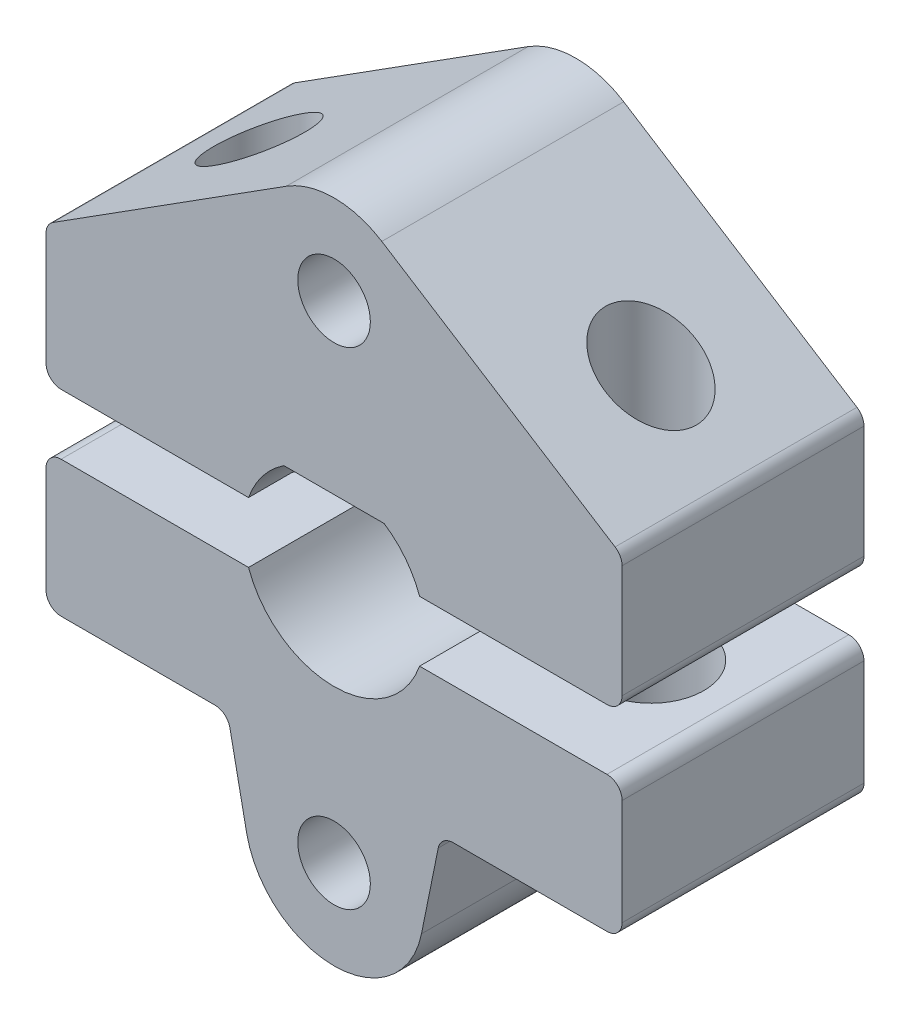
from build123d import *

# Parameters (mm, degrees)
SKETCH_1_R          = 1.2
EXTRUDE_1_DEPTH     = 8
EXTRUDE_1_2_DEPTH   = 8
SKETCH_2_R          = 1.5
CUT_EXTRUDE_1_DEPTH = 21.66397832
SKETCH_3_R          = 1.75
CUT_EXTRUDE_2_DEPTH = 4.5


with BuildPart() as part:
    # 草图1 → 凸台-拉伸1 (new body)
    with BuildSketch(Plane.XY):
        with BuildLine():
            Line((-1.658312395, 2.5), (1.658312395, 2.5))
            ThreePointArc((1.658312395, 2.5), (2.365419176, 1.84520788), (2.828427125, 1))
            Line((2.828427125, 1), (9.026279442, 1))
            ThreePointArc((9.026279442, 1), (9.379832832, 1.146446609), (9.526279442, 1.5))
            Line((9.526279442, 1.5), (9.526279442, 5.22507425))
            ThreePointArc((9.526279442, 5.22507425), (9.464414867, 5.465983671), (9.294130046, 5.647278056))
            Line((9.294130046, 5.647278056), (1.580318565, 10.541002455))
            ThreePointArc((1.580318565, 10.541002455), (0, 11), (-1.580318565, 10.541002455))
            Line((-1.580318565, 10.541002455), (-9.294130046, 5.647278056))
            ThreePointArc((-9.294130046, 5.647278056), (-9.464414867, 5.465983671), (-9.526279442, 5.22507425))
            Line((-9.526279442, 5.22507425), (-9.526279442, 1.5))
            ThreePointArc((-9.526279442, 1.5), (-9.379832832, 1.146446609), (-9.026279442, 1))
            Line((-9.026279442, 1), (-2.828427125, 1))
            ThreePointArc((-2.828427125, 1), (-2.365419176, 1.84520788), (-1.658312395, 2.5))
        make_face()
        with Locations((0, 8.05)):
            Circle(SKETCH_1_R, mode=Mode.SUBTRACT)
    extrude(amount=EXTRUDE_1_DEPTH)


with BuildPart() as body_2:
    # 草图1 → Extrude 1 2 (new body)
    with BuildSketch(Plane.XY):
        with BuildLine():
            Line((-9.026279442, -1), (-2.828427125, -1))
            ThreePointArc((-2.828427125, -1), (0, -3), (2.828427125, -1))
            Line((2.828427125, -1), (9.026279442, -1))
            ThreePointArc((9.026279442, -1), (9.379832832, -1.146446609), (9.526279442, -1.5))
            Line((9.526279442, -1.5), (9.526279442, -5))
            ThreePointArc((9.526279442, -5), (9.379832832, -5.353553391), (9.026279442, -5.5))
            Line((9.026279442, -5.5), (3.935174447, -5.5))
            ThreePointArc((3.935174447, -5.5), (3.6186464, -5.612947037), (3.445121974, -5.900760016))
            Line((3.445121974, -5.900760016), (2.891309587, -8.635515904))
            ThreePointArc((2.891309587, -8.635515904), (0, -11), (-2.891309587, -8.635515904))
            Line((-2.891309587, -8.635515904), (-3.445121974, -5.900760016))
            ThreePointArc((-3.445121974, -5.900760016), (-3.6186464, -5.612947037), (-3.935174447, -5.5))
            Line((-3.935174447, -5.5), (-9.026279442, -5.5))
            ThreePointArc((-9.026279442, -5.5), (-9.379832832, -5.353553391), (-9.526279442, -5))
            Line((-9.526279442, -5), (-9.526279442, -1.5))
            ThreePointArc((-9.526279442, -1.5), (-9.379832832, -1.146446609), (-9.026279442, -1))
        make_face()
        with Locations((0, -8.05)):
            Circle(SKETCH_1_R, mode=Mode.SUBTRACT)
    extrude(amount=EXTRUDE_1_2_DEPTH)


with BuildPart() as cut_extrude_1_tool:
    # 草图2 → 切除-拉伸1 (new, through all)
    with BuildSketch(Plane.XZ.offset(5.5)):
        with Locations(Location((6.480726944, 4, 0), (0, 0, 270))):
            Circle(SKETCH_2_R)
        with Locations(Location((-6.480726944, 4, 0), (0, 0, 270))):
            Circle(SKETCH_2_R)
    extrude(amount=-CUT_EXTRUDE_1_DEPTH)


with BuildPart() as part_1:
    add(part.part)

    # 切除-拉伸1: cut by cut_extrude_1_tool
    add(cut_extrude_1_tool.part, mode=Mode.SUBTRACT)


with BuildPart() as body_2_1:
    add(body_2.part)

    # 切除-拉伸1: cut by cut_extrude_1_tool
    add(cut_extrude_1_tool.part, mode=Mode.SUBTRACT)

    # 草图3 → 切除-拉伸2 (cut)
    with BuildSketch(Plane.XZ.offset(5.5)):
        with Locations(Location((-6.480726944, 4, 0), (0, 0, 270))):
            Circle(SKETCH_3_R)
        with Locations(Location((6.480726944, 4, 0), (0, 0, 270))):
            Circle(SKETCH_3_R)
    extrude(amount=-CUT_EXTRUDE_2_DEPTH, mode=Mode.SUBTRACT)


solid = Compound([part_1.part, body_2_1.part])
